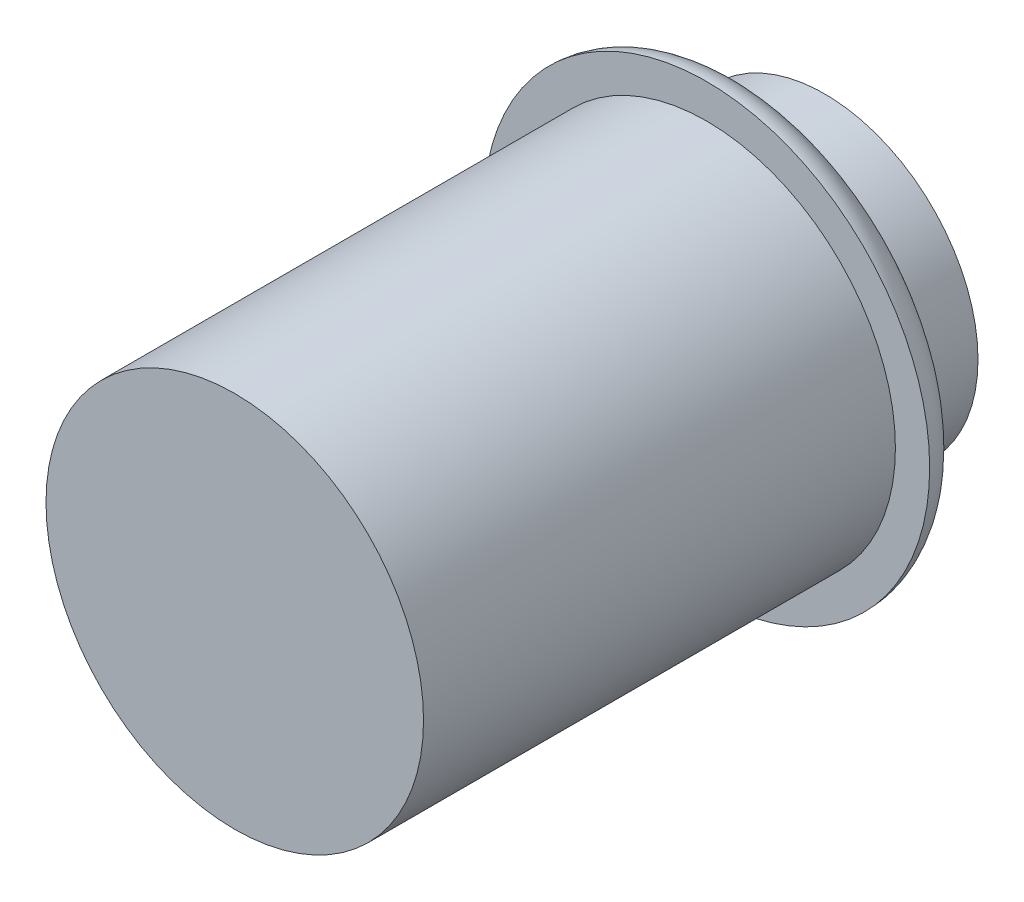
from build123d import *

# Parameters (mm, degrees)
SKETCH1_R           = 8
BOSS_EXTRUDE1_DEPTH = 20
SKETCH3_R           = 6.5
BOSS_EXTRUDE2_DEPTH = 5


with BuildPart() as part:
    # Sketch1 → Boss-Extrude1 (new body)
    with BuildSketch(Plane.XY):
        Circle(SKETCH1_R)
    extrude(amount=BOSS_EXTRUDE1_DEPTH)

    # Sketch2 → Revolve1 (revolve)
    with BuildSketch(Plane(origin=(0, 0, 0), x_dir=(1, 0, 0), z_dir=(0, 1, 0))):
        with BuildLine():
            Line((9.451478866, 0), (6.548521134, 0))
            ThreePointArc((6.548521134, 0), (8, 1.451478866), (9.451478866, 0))
        make_face()
    revolve(axis=Axis((0, 0, 0), (0, 0, -1)))

    # Sketch3 → Boss-Extrude2 (add)
    with BuildSketch(Plane(origin=(0, 0, 0), x_dir=(-1, 0, 0), z_dir=(0, 0, -1))):
        with Locations(Location((0, 0, 0), (0, 0, 180))):
            Circle(SKETCH3_R)
    extrude(amount=BOSS_EXTRUDE2_DEPTH)


solid = part.part
